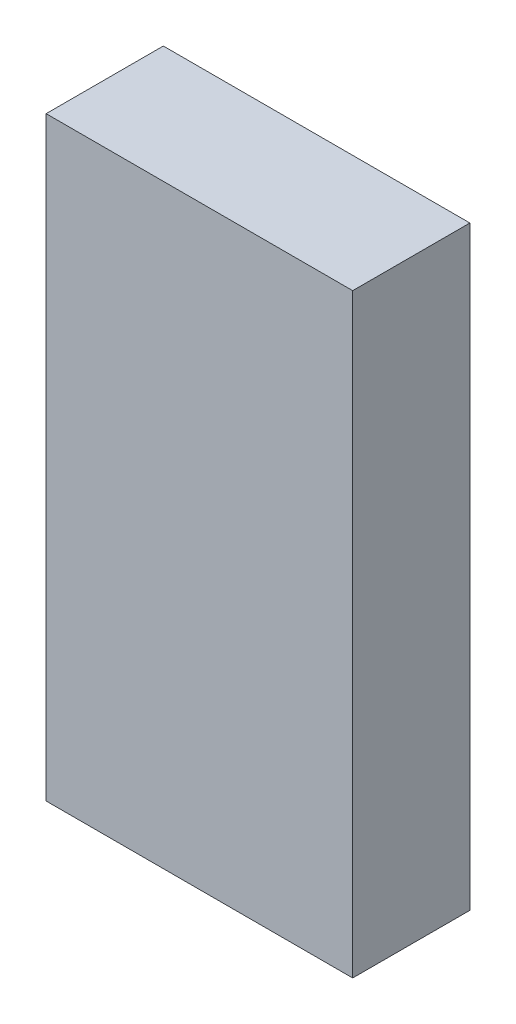
from build123d import *

# Parameters (mm, degrees)
SKETCH1_W               = 2.6162
SKETCH1_H               = 5.08
COMPONENT_OUTLINE_DEPTH = 1


with BuildPart() as part:
    # Sketch1 → Component_Outline (new body)
    with BuildSketch(Plane.XY):
        with Locations((-0.0381, 0)):
            Rectangle(SKETCH1_W, SKETCH1_H)
    extrude(amount=COMPONENT_OUTLINE_DEPTH)


solid = part.part
